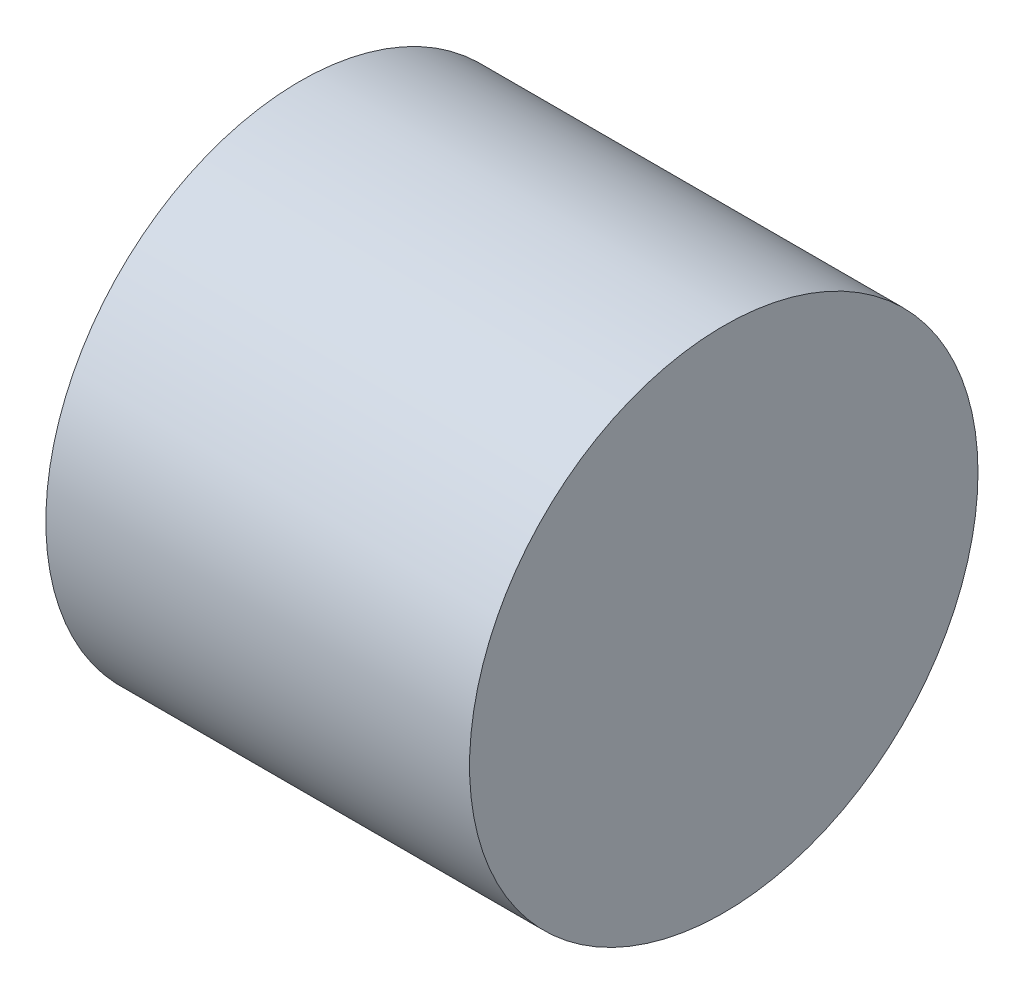
from build123d import *

# Parameters (mm, degrees)
SKETCH1_R           = 3
BOSS_EXTRUDE1_DEPTH = 5


with BuildPart() as part:
    # Sketch1 → Boss-Extrude1 (new body)
    with BuildSketch(Plane(origin=(0, 0, 0), x_dir=(0, 0, -1), z_dir=(1, 0, 0))):
        Circle(SKETCH1_R)
    extrude(amount=BOSS_EXTRUDE1_DEPTH)


solid = part.part
